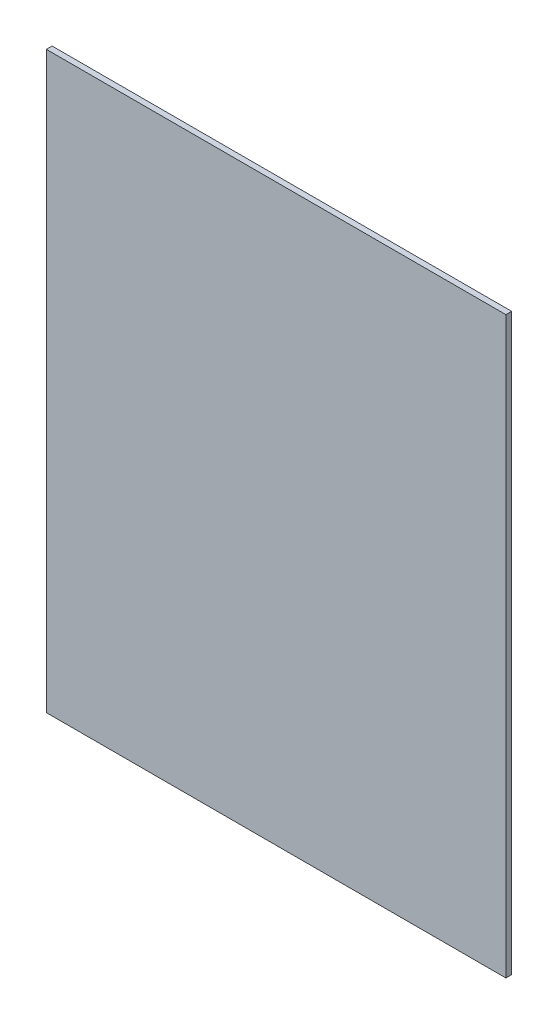
from build123d import *

# Parameters (mm, degrees)
SKETCH_1_W      = 320
SKETCH_1_H      = 400
EXTRUDE_1_DEPTH = 4


with BuildPart() as part:
    # Эскиз1 → Бобышка-Вытянуть1 (new body)
    with BuildSketch(Plane.XY):
        with Locations((160, 200)):
            Rectangle(SKETCH_1_W, SKETCH_1_H)
    extrude(amount=EXTRUDE_1_DEPTH)


solid = part.part
